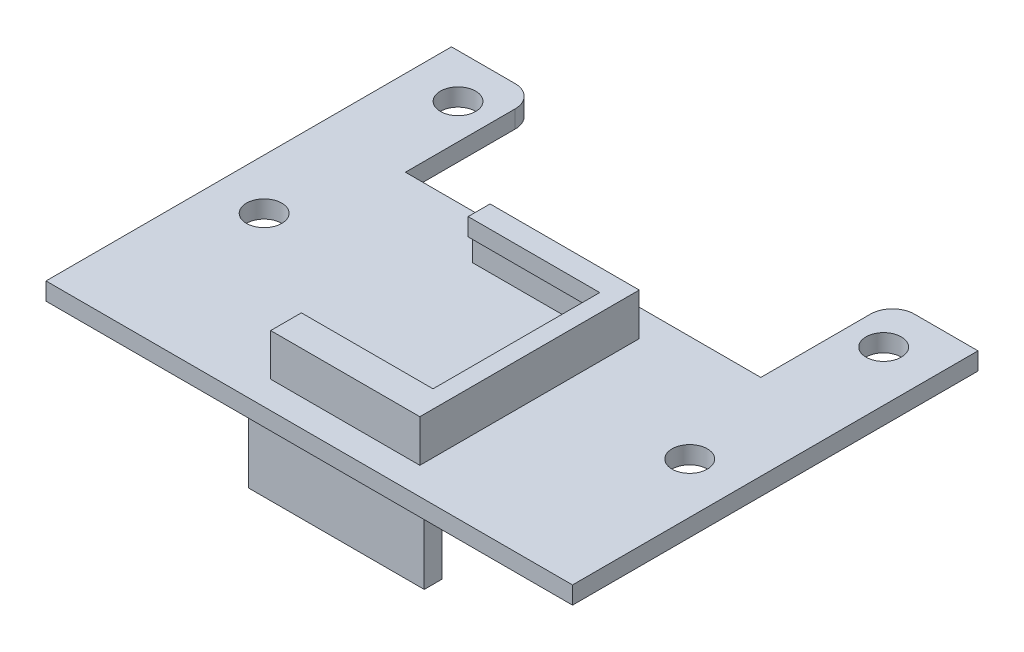
from build123d import *

# Parameters (mm, degrees)
SKETCH1_R           = 2.5527
BOSS_EXTRUDE1_DEPTH = 2.54
SKETCH7_W           = 76.2
SKETCH7_H           = 17.915396906
BOSS_EXTRUDE5_DEPTH = 2.54
BOSS_EXTRUDE2_DEPTH = 3.556
SKETCH4_W           = 31.75
SKETCH4_H           = 3.556
CUT_EXTRUDE1_DEPTH  = 2.54
BOSS_EXTRUDE3_DEPTH = 2.54
BOSS_EXTRUDE4_DEPTH = 12.7


with BuildPart() as part:
    # Sketch1 → Boss-Extrude1 (new body)
    with BuildSketch(Plane(origin=(0, 0, 0), x_dir=(1, 0, 0), z_dir=(0, 1, 0))):
        with BuildLine():
            Line((38.1, -20.3835), (-38.1, -20.3835))
            Line((-38.1, -20.3835), (-38.1, 20.3835))
            Line((-38.1, 20.3835), (-28.8925, 20.3835))
            ThreePointArc((-28.8925, 20.3835), (-26.64743597, 19.45356403), (-25.7175, 17.2085))
            Line((-25.7175, 17.2085), (-25.7175, 1.3335))
            Line((-25.7175, 1.3335), (25.7175, 1.3335))
            Line((25.7175, 1.3335), (25.7175, 17.2085))
            ThreePointArc((25.7175, 17.2085), (26.64743597, 19.45356403), (28.8925, 20.3835))
            Line((28.8925, 20.3835), (38.1, 20.3835))
            Line((38.1, 20.3835), (38.1, -20.3835))
        make_face()
        with Locations(Location((30.7975, -14.0335, 0), (0, 0, 270))):
            Circle(SKETCH1_R, mode=Mode.SUBTRACT)
        with Locations(Location((30.7975, 14.0335, 0), (0, 0, 270))):
            Circle(SKETCH1_R, mode=Mode.SUBTRACT)
        with Locations(Location((-30.7975, -14.0335, 0), (0, 0, 90))):
            Circle(SKETCH1_R, mode=Mode.SUBTRACT)
        with Locations(Location((-30.7975, 14.0335, 0), (0, 0, 90))):
            Circle(SKETCH1_R, mode=Mode.SUBTRACT)
    extrude(amount=BOSS_EXTRUDE1_DEPTH)

    # Sketch7 → Boss-Extrude5 (add)
    with BuildSketch(Plane(origin=(0, 2.54, 0), x_dir=(1, 0, 0), z_dir=(0, 1, 0))):
        with Locations((0, -29.341198453)):
            Rectangle(SKETCH7_W, SKETCH7_H)
    extrude(amount=-BOSS_EXTRUDE5_DEPTH)

    # Sketch3 → Boss-Extrude2 (add)
    with BuildSketch(Plane(origin=(0, 2.54, 0), x_dir=(1, 0, 0), z_dir=(0, 1, 0))):
        Polygon((-12.065, -2.607698453), (-12.065, -5.147698453), (-9.525, -5.147698453), (9.525, -5.147698453), (9.525, -31.817698453), (-9.525, -31.817698453), (-12.065, -31.817698453), (-12.065, -34.357698453), (12.065, -34.357698453), (12.065, -2.607698453), align=None)
    extrude(amount=BOSS_EXTRUDE2_DEPTH)

    # Sketch4 → Cut-Extrude1 (cut)
    with BuildSketch(Plane.ZY.offset(12.065)):
        with Locations((18.482698453, 4.318)):
            Rectangle(SKETCH4_W, SKETCH4_H)
    extrude(amount=-CUT_EXTRUDE1_DEPTH, mode=Mode.SUBTRACT)

    # Sketch5 → Boss-Extrude3 (add)
    with BuildSketch(Plane(origin=(0, 6.096, 0), x_dir=(1, 0, 0), z_dir=(0, 1, 0))):
        Polygon((-9.525, -2.607698453), (-9.525, -5.782698453), (9.525, -5.782698453), (9.525, -29.912698453), (-9.525, -29.912698453), (-9.525, -34.357698453), (12.065, -34.357698453), (12.065, -2.607698453), align=None)
    extrude(amount=BOSS_EXTRUDE3_DEPTH)

    # Sketch6 → Boss-Extrude4 (add)
    with BuildSketch(Plane(origin=(0, 0, 0), x_dir=(-1, 0, 0), z_dir=(0, -1, 0))):
        Polygon((22.86, -13.402698453), (22.86, -18.482698453), (22.86, -23.562698453), (25.4, -23.562698453), (25.4, -13.402698453), align=None)
        Polygon((-12.7, -2.607698453), (-12.7, -5.147698453), (0, -5.147698453), (12.7, -5.147698453), (12.7, -2.607698453), align=None)
        Polygon((-12.7, -31.817698453), (0, -31.817698453), (12.7, -31.817698453), (12.7, -34.357698453), (-12.7, -34.357698453), align=None)
    extrude(amount=BOSS_EXTRUDE4_DEPTH)


solid = part.part
